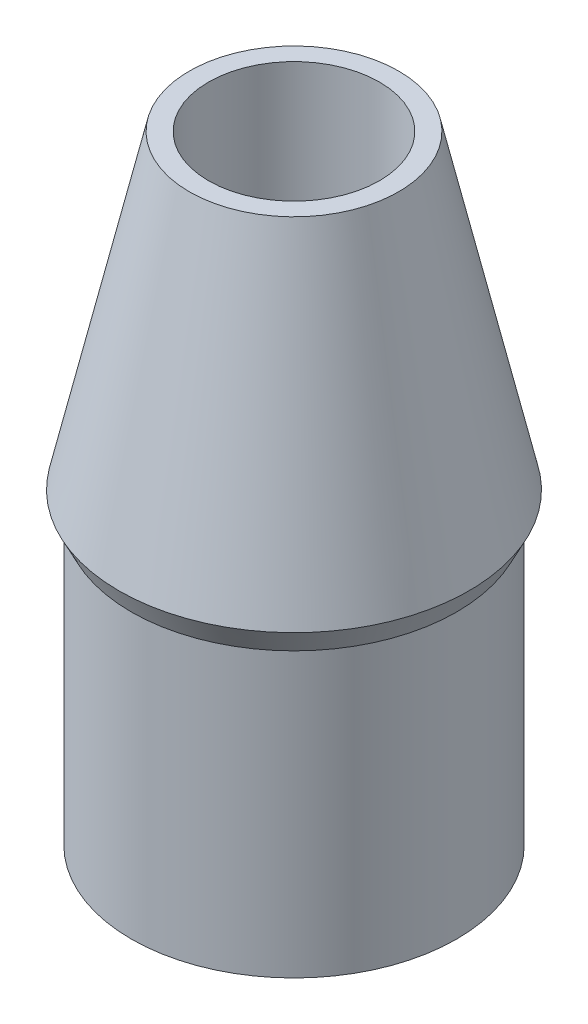
from build123d import *

# Parameters (mm, degrees)
F_3_8_24_TAPPED_HOLE1_D     = 8.4328
F_3_8_24_TAPPED_HOLE1_DEPTH = 24.3459
F_3_8_24_TAPPED_HOLE1_TIP   = 2.533468714


with BuildPart() as part:
    # Sketch3 → Revolve1 (revolve)
    with BuildSketch(Plane.XY, mode=Mode.PRIVATE) as revolve1_sk:
        Polygon((8.0264, -13.97), (0, -13.97), (0, 16.51), (5.159901878, 16.51), (8.630843425, 1.204032551), (8.0264, 0), align=None)
    revolve(revolve1_sk.sketch.rotate(Axis((0, 16.51, 0), (0, -1, 0)), 90), axis=Axis((0, 16.51, 0), (0, -1, 0)))

    # 3/8-24 Tapped Hole1
    with Locations(Plane(origin=(0, 16.51, 0), x_dir=(1, 0, 0), z_dir=(0, 1, 0))):
        with Locations((0, 0)):
            Hole(F_3_8_24_TAPPED_HOLE1_D / 2, depth=F_3_8_24_TAPPED_HOLE1_DEPTH)
            with Locations((0, 0, -(F_3_8_24_TAPPED_HOLE1_DEPTH + F_3_8_24_TAPPED_HOLE1_TIP / 2))):  # 118° drill point
                Cone(0, F_3_8_24_TAPPED_HOLE1_D / 2, F_3_8_24_TAPPED_HOLE1_TIP, mode=Mode.SUBTRACT)


solid = part.part
